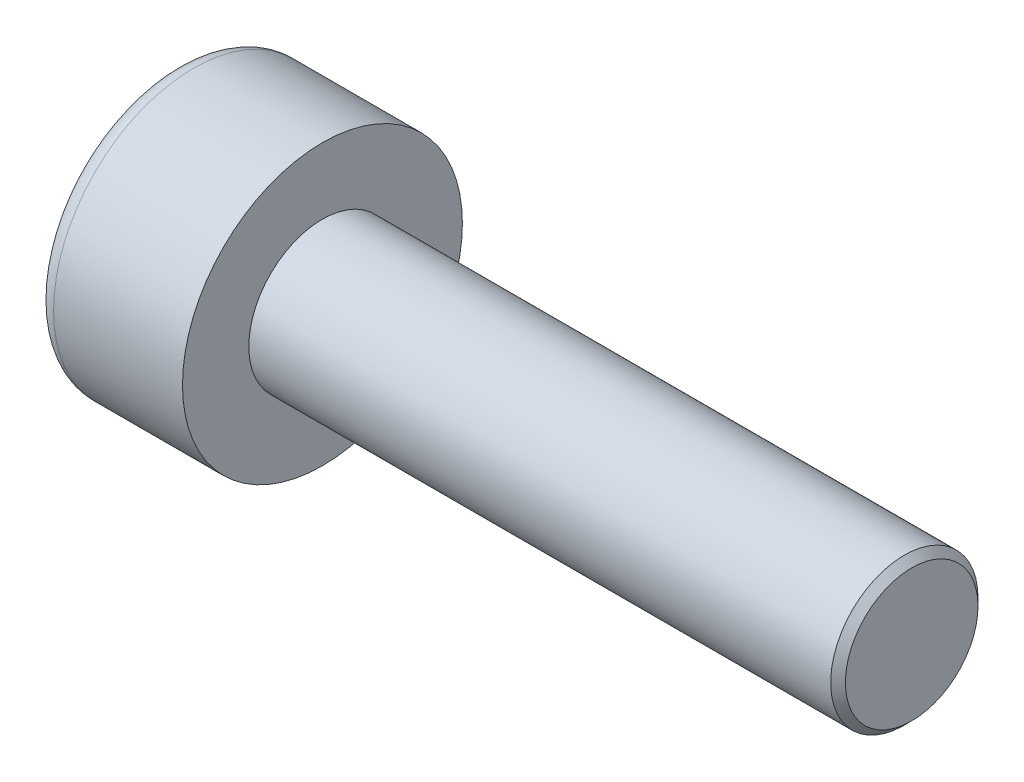
from build123d import *

# Parameters (mm, degrees)
SKETCH1_R           = 1.9
BASEHEAD_DEPTH      = 2
SKETCH2_R           = 1
BASEBODY_DEPTH      = 8
HEXAGONSOCKET_DEPTH = 1
TOPFILLET_R         = 0.25
CHAMFER1_SIZE       = 0.1


with BuildPart() as part:
    # Sketch1 → BaseHead (new body)
    with BuildSketch(Plane(origin=(0, 0, 0), x_dir=(0, 0, -1), z_dir=(1, 0, 0))):
        Circle(SKETCH1_R)
    extrude(amount=BASEHEAD_DEPTH)

    # Sketch2 → BaseBody (add)
    with BuildSketch(Plane(origin=(2, 0, 0), x_dir=(0, 0, -1), z_dir=(1, 0, 0))):
        Circle(SKETCH2_R)
    extrude(amount=BASEBODY_DEPTH)

    # Sketch3 → HexagonSocket (cut)
    with BuildSketch(Plane(origin=(0, 0, 0), x_dir=(0, 0, -1), z_dir=(1, 0, 0))):
        Polygon((0.866025404, 0), (0.433012702, 0.75), (-0.433012702, 0.75), (-0.866025404, 0), (-0.433012702, -0.75), (0.433012702, -0.75), align=None)
    extrude(amount=HEXAGONSOCKET_DEPTH, mode=Mode.SUBTRACT)

    # Sketch4 → Cut-Revolve1 (revolve, cut)
    with BuildSketch(Plane(origin=(-4.19613823, 0.75, 0), x_dir=(-1, 0, 0), z_dir=(0, 0, 1)), mode=Mode.PRIVATE) as cut_revolve1_sk:
        Polygon((-5.19613823, 1.5), (-5.629150931, 0.75), (-5.19613823, 0.75), align=None)
    revolve(cut_revolve1_sk.sketch.rotate(Axis((0.838992387, 0, 0), (-1, 0, 0)), 90), axis=Axis((0.838992387, 0, 0), (-1, 0, 0)), mode=Mode.SUBTRACT)

    # TopFillet
    topfillet_edges = [part.edges().sort_by_distance(p)[0] for p in [
        (0, 0, 1.9),
    ]]
    fillet(topfillet_edges, radius=TOPFILLET_R)

    # Chamfer1
    chamfer1_edges = [part.edges().sort_by_distance(p)[0] for p in [
        (10, 0, 1),
    ]]
    chamfer(chamfer1_edges, length=CHAMFER1_SIZE)


solid = part.part
